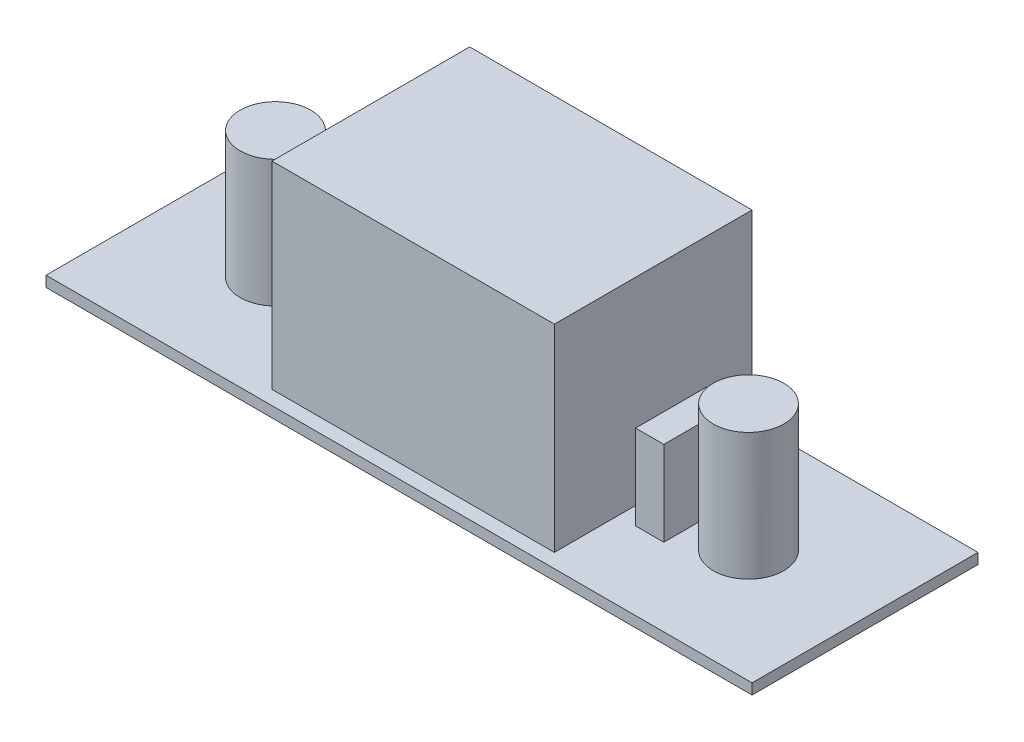
from build123d import *

# Parameters (mm, degrees)
SKETCH_1_W      = 100
SKETCH_1_H      = 32
EXTRUDE_1_DEPTH = 1.5
SKETCH_2_W      = 40
SKETCH_2_H      = 28
EXTRUDE_2_DEPTH = 28
SKETCH_3_R      = 5
EXTRUDE_3_DEPTH = 18
SKETCH_4_W      = 4
SKETCH_4_H      = 10
EXTRUDE_4_DEPTH = 12


with BuildPart() as part:
    # 草图1 → 凸台-拉伸1 (new body)
    with BuildSketch(Plane(origin=(0, 0, 0), x_dir=(1, 0, 0), z_dir=(0, 1, 0))):
        with Locations((50, 16)):
            Rectangle(SKETCH_1_W, SKETCH_1_H)
    extrude(amount=EXTRUDE_1_DEPTH)

    # 草图2 → 凸台-拉伸2 (add)
    with BuildSketch(Plane(origin=(0, 1.5, 0), x_dir=(1, 0, 0), z_dir=(0, 1, 0))):
        with Locations((50, 16.000816198)):
            Rectangle(SKETCH_2_W, SKETCH_2_H)
    extrude(amount=EXTRUDE_2_DEPTH)

    # 草图3 → 凸台-拉伸3 (add)
    with BuildSketch(Plane(origin=(0, 1.5, 0), x_dir=(1, 0, 0), z_dir=(0, 1, 0))):
        with Locations(Location((16.5, 16, 0), (0, 0, 90))):
            Circle(SKETCH_3_R)
        with Locations(Location((83.5, 16, 0), (0, 0, 90))):
            Circle(SKETCH_3_R)
    extrude(amount=EXTRUDE_3_DEPTH)

    # 草图4 → 凸台-拉伸4 (add)
    with BuildSketch(Plane(origin=(0, 1.5, 0), x_dir=(1, 0, 0), z_dir=(0, 1, 0))):
        with Locations((74.5, 16)):
            Rectangle(SKETCH_4_W, SKETCH_4_H)
    extrude(amount=EXTRUDE_4_DEPTH)


solid = part.part
